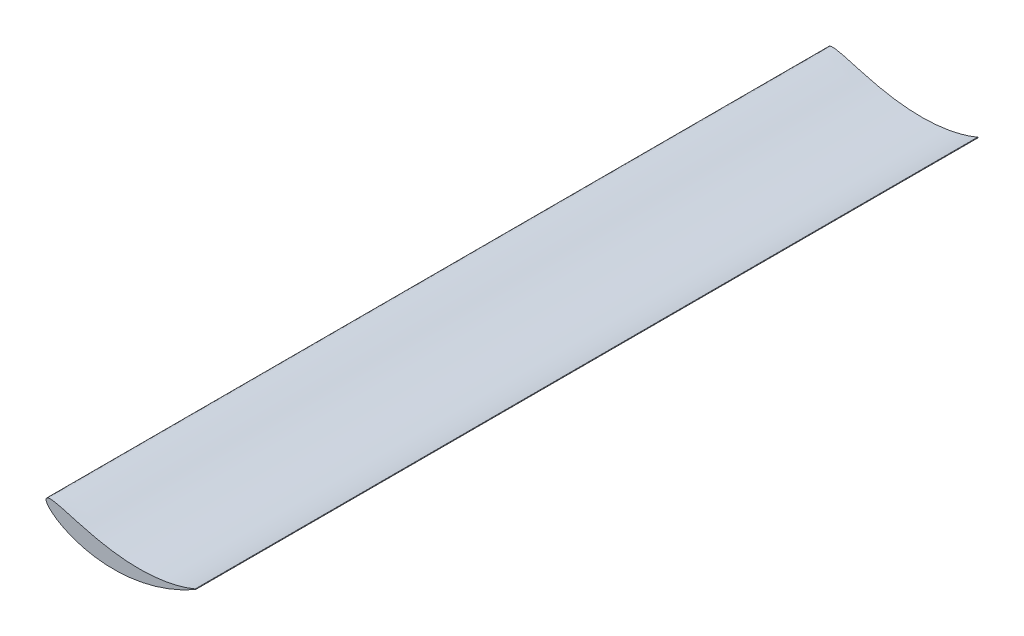
from build123d import *

# Parameters (mm, degrees)
BOSS_EXTRUDE2_DEPTH = 500


with BuildPart() as part:
    # Sketch2 → Boss-Extrude2 (new, symmetric)
    with BuildSketch(Plane.XY):
        with BuildLine():
            ThreePointArc((190.619976475, -4.113563922), (191.120009682, -4.277332033), (190.956241573, -4.77736524))
            add(Edge.make_bspline(
                [(190.956241573, -4.77736524), (190.824351331, -4.850734656), (189.266236247, -5.716311549), (186.010858372, -7.493605265), (180.823647875, -10.214726931), (174.698235284, -13.256014318), (167.591359089, -16.539576282), (159.488349753, -19.954727654), (150.393963735, -23.365050943), (140.348546413, -26.612897793), (129.433550223, -29.52489825), (117.779572077, -31.923999878), (105.569465286, -33.64831355), (93.034005945, -34.56356047), (80.442649214, -34.585096665), (68.085686643, -33.687001479), (56.253297272, -31.909938952), (45.212267629, -29.357821392), (35.18655018, -26.186468616), (26.343549194, -22.585403233), (18.78766504, -18.759301824), (12.563296716, -14.906936471), (7.660206756, -11.205284673), (4.027604275, -7.803248784), (1.573653009, -4.796291384), (0.201464862, -2.252662899), (-0.213471604, -0.06899), (0.597068393, 1.674977484), (2.357212283, 2.58171888), (4.672962002, 2.919107572), (7.602116552, 2.830896678), (11.099165509, 2.353125626), (15.123144461, 1.538988042), (19.622681089, 0.440148356), (24.551910828, -0.886957346), (29.867907995, -2.386313545), (35.530801273, -4.003952145), (41.503381118, -5.68788873), (47.750244483, -7.389081418), (54.236719888, -9.063934352), (60.929227826, -10.671331854), (67.794322796, -12.175446037), (74.798612286, -13.544692531), (81.90874001, -14.751698968), (89.090951137, -15.774699654), (96.311448395, -16.595032008), (103.53616289, -17.199829314), (110.730986166, -17.58016163), (117.861845412, -17.731640773), (124.89487431, -17.654325895), (131.796397968, -17.352320574), (138.533291685, -16.834340768), (145.072823387, -16.112929151), (151.383194893, -15.204858341), (157.433178918, -14.129977131), (163.192716512, -12.912383637), (168.632500235, -11.579479452), (173.724620383, -10.162372786), (178.441318245, -8.693644841), (182.756848014, -7.210463104), (186.64446644, -5.751487153), (189.214186248, -4.708361937), (190.487686373, -4.169755018), (190.619976475, -4.113563922)],
                knots=[0.024527699, 0.024527699, 0.024527699, 0.024527699, 0.025589209, 0.037067816, 0.050854502, 0.066985023, 0.085457836, 0.106225288, 0.129179984, 0.15414868, 0.180883335, 0.209058052, 0.238271881, 0.268058238, 0.297903876, 0.327269841, 0.355623842, 0.382465397, 0.407355501, 0.429934859, 0.449938972, 0.46720151, 0.481654744, 0.493326476, 0.502345384, 0.508967218, 0.513683959, 0.517466281, 0.521650737, 0.527066359, 0.533951819, 0.542299609, 0.552017631, 0.562981801, 0.575062675, 0.588129088, 0.602056582, 0.616727009, 0.632028814, 0.64785818, 0.664118458, 0.680718254, 0.697573164, 0.714603084, 0.731732438, 0.748889669, 0.766005495, 0.783014285, 0.799851871, 0.816455186, 0.832763309, 0.848714238, 0.864246917, 0.879299022, 0.893808281, 0.907709696, 0.920937867, 0.933423618, 0.945096562, 0.955881369, 0.965700785, 0.974472498, 0.975490117, 0.975490117, 0.975490117, 0.975490117], degree=3))
        make_face()
    extrude(amount=BOSS_EXTRUDE2_DEPTH, both=True)


solid = part.part
